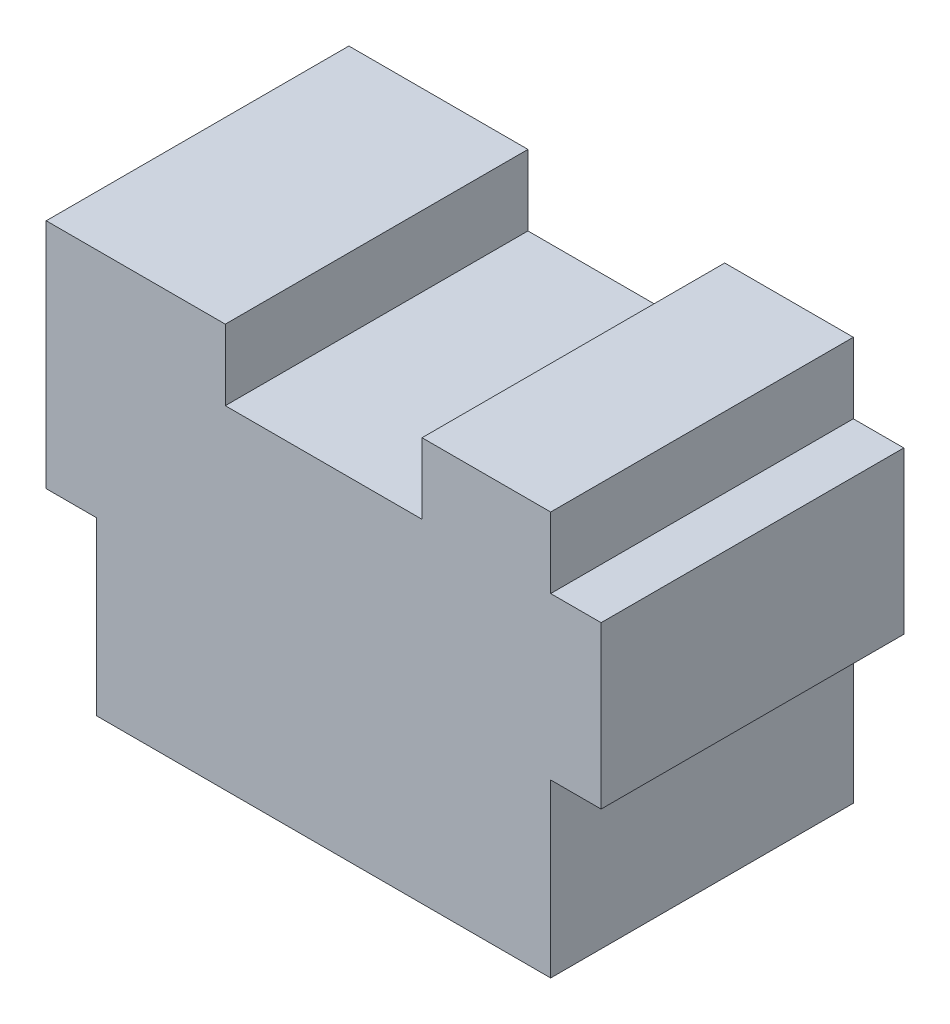
from build123d import *

# Parameters (mm, degrees)
EXTRUDE_1_DEPTH                 = 30
CUT_EXTRUDE_1_REACH             = 47.346
CUT_EXTRUDE_1_DIRECTION_2_REACH = 47.346


with BuildPart() as part:
    # Эскиз1 → Бобышка-Вытянуть1 (new body)
    with BuildSketch(Plane.XY):
        Polygon((-22.5, -3), (-22.5, -20), (22.5, -20), (22.5, -3), (27.5, -3), (27.5, 13), (22.5, 13), (22.5, 20), (9.75, 20), (9.75, 13), (-9.75, 13), (-9.75, 20), (-27.5, 20), (-27.5, -3), align=None)
    extrude(amount=EXTRUDE_1_DEPTH)

    # Вырез-Вытянуть1: up to this face of the body (flat: up to its plane)
    cut_extrude_1_end = Plane(part.part.faces().sort_by_distance((-9.75, 16.5, 15))[0])
    # Эскиз2 → Вырез-Вытянуть1 (cut, up to the picked face)
    with BuildSketch(Plane(origin=(0, 0, 0), x_dir=(0, 0, -1), z_dir=(1, 0, 0)), mode=Mode.PRIVATE) as cut_extrude_1_sk1:
        Polygon((0, -20), (0, -11), (-26, -20), align=None)
    cut_extrude_1_tool1 = split(extrude(cut_extrude_1_sk1.sketch, amount=-CUT_EXTRUDE_1_REACH, mode=Mode.PRIVATE), bisect_by=cut_extrude_1_end, keep=Keep.BOTH, mode=Mode.PRIVATE)
    add(cut_extrude_1_tool1.solids().sort_by(Axis((0, -17, 8.666667), (-1, 0, 0)))[0], mode=Mode.SUBTRACT)

    # Вырез-Вытянуть1 direction 2: up to this face of the body (flat: up to its plane)
    cut_extrude_1_direction_2_end = Plane(part.part.faces().sort_by_distance((9.75, 16.5, 15))[0])
    # Эскиз2 → Вырез-Вытянуть1 direction 2 (cut, up to the picked face)
    with BuildSketch(Plane(origin=(0, 0, 0), x_dir=(0, 0, -1), z_dir=(1, 0, 0)), mode=Mode.PRIVATE) as cut_extrude_1_direction_2_sk1:
        Polygon((0, -20), (0, -11), (-26, -20), align=None)
    cut_extrude_1_direction_2_tool1 = split(extrude(cut_extrude_1_direction_2_sk1.sketch, amount=CUT_EXTRUDE_1_DIRECTION_2_REACH, mode=Mode.PRIVATE), bisect_by=cut_extrude_1_direction_2_end, keep=Keep.BOTH, mode=Mode.PRIVATE)
    add(cut_extrude_1_direction_2_tool1.solids().sort_by(Axis((0, -17, 8.666667), (1, 0, 0)))[0], mode=Mode.SUBTRACT)


solid = part.part
